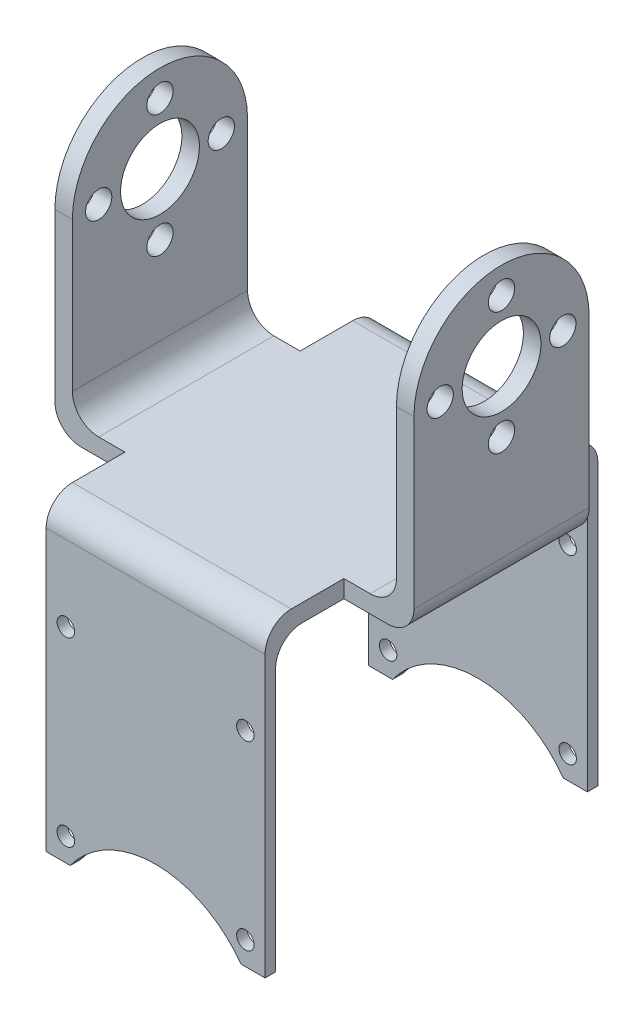
from build123d import *

# Parameters (mm, degrees)
EXTRUDE_1_DEPTH     = 2
SKETCH_2_W          = 2
SKETCH_2_H          = 20
EXTRUDE_2_DEPTH     = 40
FILLET_1_R          = 3
SKETCH_4_W          = 25
SKETCH_4_H          = 1.2
EXTRUDE_3_DEPTH     = 40
FILLET_2_R          = 3
SKETCH_6_R          = 4.5
SKETCH_6_R_2        = 1.5
CUT_EXTRUDE_2_DEPTH = 62.692787261
SKETCH_7_R          = 1
CUT_EXTRUDE_3_DEPTH = 59.857879676


with BuildPart() as part:
    # 草图1 → 凸台-拉伸1 (new body)
    with BuildSketch(Plane(origin=(0, 0, 0), x_dir=(1, 0, 0), z_dir=(0, 1, 0))):
        Polygon((12.5, -10), (12.5, -19), (-12.5, -19), (-12.5, -10), (-20.5, -10), (-20.5, 10), (-12.5, 10), (-12.5, 19), (12.5, 19), (12.5, 10), (20.5, 10), (20.5, -10), align=None)
    extrude(amount=EXTRUDE_1_DEPTH)

    # 草图2 → 凸台-拉伸2 (add)
    with BuildSketch(Plane(origin=(0, 2, 0), x_dir=(1, 0, 0), z_dir=(0, 1, 0))):
        with Locations((-19.5, 0)):
            Rectangle(SKETCH_2_W, SKETCH_2_H)
        with Locations((19.5, 0)):
            Rectangle(SKETCH_2_W, SKETCH_2_H)
    extrude(amount=EXTRUDE_2_DEPTH)

    # 圆角1
    fillet_1_edges = [part.edges().sort_by_distance(p)[0] for p in [
        (-20.5, 0, 0),
        (20.5, 0, 0),
        (-18.5, 2, 0),
        (18.5, 2, 0),
    ]]
    fillet(fillet_1_edges, radius=FILLET_1_R)

    # 草图4 → 凸台-拉伸3 (add)
    with BuildSketch(Plane.XZ):
        with Locations((0, 18.4)):
            Rectangle(SKETCH_4_W, SKETCH_4_H)
        with Locations((0, -18.4)):
            Rectangle(SKETCH_4_W, SKETCH_4_H)
    extrude(amount=EXTRUDE_3_DEPTH)

    # 圆角2
    fillet_2_edges = [part.edges().sort_by_distance(p)[0] for p in [
        (0, 2, -19),
        (0, 2, 19),
        (0, 0, 17.8),
        (0, 0, -17.8),
    ]]
    fillet(fillet_2_edges, radius=FILLET_2_R)

    # 草图6 → 切除-拉伸2 (cut, through all)
    with BuildSketch(Plane.ZY.offset(20.5)):
        with Locations((0, 22)):
            Circle(SKETCH_6_R)
        with Locations((0, 15)):
            Circle(SKETCH_6_R_2)
        with Locations((-7, 22)):
            Circle(SKETCH_6_R_2)
        with Locations((0, 29)):
            Circle(SKETCH_6_R_2)
        with Locations((7, 22)):
            Circle(SKETCH_6_R_2)
        with BuildLine():
            Line((-10, 22), (-10, 42))
            Line((-10, 42), (10, 42))
            Line((10, 42), (10, 22))
            ThreePointArc((10, 22), (0, 32), (-10, 22))
        make_face()
    extrude(amount=-CUT_EXTRUDE_2_DEPTH, mode=Mode.SUBTRACT)

    # 草图7 → 切除-拉伸3 (cut, through all)
    with BuildSketch(Plane.XY.offset(19)):
        with Locations((-10.25, -30.35)):
            Circle(SKETCH_7_R)
        with Locations((-10.25, -9.65)):
            Circle(SKETCH_7_R)
        with Locations((10.25, -9.65)):
            Circle(SKETCH_7_R)
        with Locations((10.25, -30.35)):
            Circle(SKETCH_7_R)
        with BuildLine():
            Line((-12.5, -33), (-9.746794345, -33))
            ThreePointArc((-9.746794345, -33), (0, -28), (9.746794345, -33))
            Line((9.746794345, -33), (12.5, -33))
            Line((12.5, -33), (12.5, -40))
            Line((12.5, -40), (-12.5, -40))
            Line((-12.5, -40), (-12.5, -33))
        make_face()
    extrude(amount=-CUT_EXTRUDE_3_DEPTH, mode=Mode.SUBTRACT)


solid = part.part
